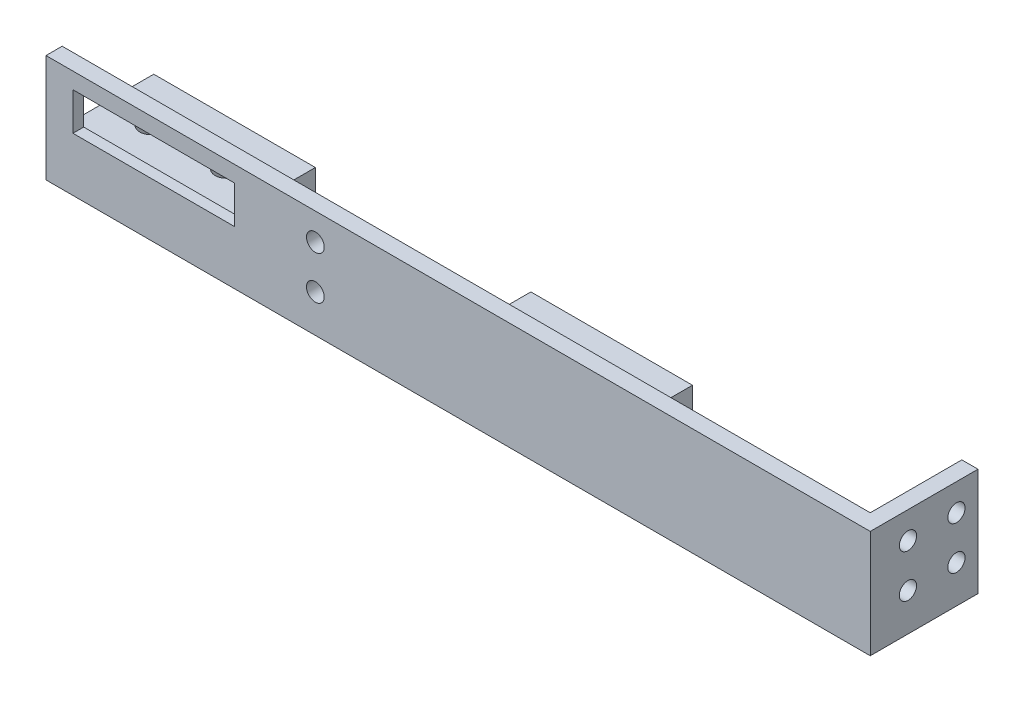
from build123d import *

# Parameters (mm, degrees)
SKETCH1_W           = 20
SKETCH1_H           = 20
BOSS_EXTRUDE1_DEPTH = 3
SKETCH2_W           = 3
SKETCH2_H           = 20
BOSS_EXTRUDE2_DEPTH = 150
SKETCH3_W           = 17
SKETCH3_H           = 3
BOSS_EXTRUDE3_DEPTH = 150
SKETCH4_R           = 1.6
CUT_EXTRUDE1_DEPTH  = 3
SKETCH5_W           = 30
SKETCH5_H           = 17
BOSS_EXTRUDE4_DEPTH = 4
SKETCH6_W           = 30
SKETCH6_H           = 17
BOSS_EXTRUDE5_DEPTH = 4
SKETCH9_R           = 2.05
SKETCH9_R_2         = 2.1
CUT_EXTRUDE4_DEPTH  = 186.434844337
SKETCH10_R          = 4
CUT_EXTRUDE5_DEPTH  = 2.5
SKETCH11_W          = 30
SKETCH11_H          = 7
CUT_EXTRUDE6_DEPTH  = 3
CHAMFER2_SIZE       = 1
CHAMFER3_SIZE       = 3
SKETCH12_W          = 3.1
SKETCH12_H          = 17
CUT_EXTRUDE7_DEPTH  = 3
SKETCH13_R          = 1.65
CUT_EXTRUDE8_DEPTH  = 3
SKETCH14_R          = 3
CUT_EXTRUDE9_DEPTH  = 6


with BuildPart() as part:
    # Sketch1 → Boss-Extrude1 (new body)
    with BuildSketch(Plane(origin=(0, 0, 0), x_dir=(0, 0, -1), z_dir=(1, 0, 0))):
        with Locations((-98.245468701, -9.501201475)):
            Rectangle(SKETCH1_W, SKETCH1_H)
    extrude(amount=BOSS_EXTRUDE1_DEPTH)

    # Sketch2 → Boss-Extrude2 (add)
    with BuildSketch(Plane.ZY):
        with Locations((106.745468701, -9.501201475)):
            Rectangle(SKETCH2_W, SKETCH2_H)
    extrude(amount=BOSS_EXTRUDE2_DEPTH)

    # Sketch3 → Boss-Extrude3 (add)
    with BuildSketch(Plane.ZY):
        with Locations((96.745468701, -18.001201475)):
            Rectangle(SKETCH3_W, SKETCH3_H)
    extrude(amount=BOSS_EXTRUDE3_DEPTH)

    # Sketch4 → Cut-Extrude1 (cut)
    with BuildSketch(Plane(origin=(3, 0, 0), x_dir=(0, 0, -1), z_dir=(1, 0, 0))):
        with Locations((-101.245468701, -4.501201475)):
            Circle(SKETCH4_R)
        with Locations((-92.245468701, -4.501201475)):
            Circle(SKETCH4_R)
        with Locations((-92.245468701, -12.501201475)):
            Circle(SKETCH4_R)
        with Locations((-101.245468701, -12.501201475)):
            Circle(SKETCH4_R)
    extrude(amount=-CUT_EXTRUDE1_DEPTH, mode=Mode.SUBTRACT)

    # Sketch5 → Boss-Extrude4 (add)
    with BuildSketch(Plane(origin=(0, -16.501201475, 0), x_dir=(1, 0, 0), z_dir=(0, 1, 0))):
        with Locations((-135, -96.745468701)):
            Rectangle(SKETCH5_W, SKETCH5_H)
    extrude(amount=BOSS_EXTRUDE4_DEPTH)

    # Sketch6 → Boss-Extrude5 (add)
    with BuildSketch(Plane(origin=(0, -16.501201475, 0), x_dir=(1, 0, 0), z_dir=(0, 1, 0))):
        with Locations((-65, -96.745468701)):
            Rectangle(SKETCH6_W, SKETCH6_H)
    extrude(amount=BOSS_EXTRUDE5_DEPTH)

    # Sketch9 → Cut-Extrude4 (cut, through all)
    with BuildSketch(Plane(origin=(0, -12.501201475, 0), x_dir=(1, 0, 0), z_dir=(0, 1, 0))):
        with Locations(Location((-58, -96.745468701, 0), (0, 0, 270))):
            Circle(SKETCH9_R)
        with Locations(Location((-72, -96.745468701, 0), (0, 0, 270))):
            Circle(SKETCH9_R_2)
        with Locations(Location((-128, -96.745468701, 0), (0, 0, 270))):
            Circle(SKETCH9_R_2)
        with Locations(Location((-142, -96.745468701, 0), (0, 0, 270))):
            Circle(SKETCH9_R_2)
    extrude(amount=-CUT_EXTRUDE4_DEPTH, mode=Mode.SUBTRACT)

    # Sketch10 → Cut-Extrude5 (cut)
    with BuildSketch(Plane.XZ.offset(19.501201475)):
        with Locations(Location((-142, 96.745468701, 0), (0, 0, 270))):
            Circle(SKETCH10_R)
        with Locations(Location((-128, 96.745468701, 0), (0, 0, 270))):
            Circle(SKETCH10_R)
        with Locations(Location((-72, 96.745468701, 0), (0, 0, 270))):
            Circle(SKETCH10_R)
        with Locations(Location((-58, 96.745468701, 0), (0, 0, 270))):
            Circle(SKETCH10_R)
    extrude(amount=-CUT_EXTRUDE5_DEPTH, mode=Mode.SUBTRACT)

    # Sketch11 → Cut-Extrude6 (cut)
    with BuildSketch(Plane.XY.offset(108.245468701)):
        with Locations((-130, -6.001201475)):
            Rectangle(SKETCH11_W, SKETCH11_H)
    extrude(amount=-CUT_EXTRUDE6_DEPTH, mode=Mode.SUBTRACT)

    # Chamfer2
    chamfer2_edges = [part.edges().sort_by_distance(p)[0] for p in [
        (-145, -6.001201475, 105.245468701),
        (-130, -2.501201475, 105.245468701),
        (-115, -6.001201475, 105.245468701),
        (-130, -9.501201475, 105.245468701),
    ]]
    chamfer(chamfer2_edges, length=CHAMFER2_SIZE)

    # Chamfer3
    chamfer3_edges = [part.edges().sort_by_distance(p)[0] for p in [
        (-100, -16.501201475, 105.245468701),
        (-25, -16.501201475, 105.245468701),
    ]]
    chamfer(chamfer3_edges, length=CHAMFER3_SIZE)

    # Sketch12 → Cut-Extrude7 (cut)
    with BuildSketch(Plane(origin=(0, -16.501201475, 0), x_dir=(1, 0, 0), z_dir=(0, 1, 0))):
        with Locations((-118.45, -96.745468701)):
            Rectangle(SKETCH12_W, SKETCH12_H)
        with Locations((-81.55, -96.745468701)):
            Rectangle(SKETCH12_W, SKETCH12_H)
        with Locations((-48.45, -96.745468701)):
            Rectangle(SKETCH12_W, SKETCH12_H)
    extrude(amount=CUT_EXTRUDE7_DEPTH, mode=Mode.SUBTRACT)

    # Sketch13 → Cut-Extrude8 (cut)
    with BuildSketch(Plane(origin=(0, 0, 105.245468701), x_dir=(-1, 0, 0), z_dir=(0, 0, -1))):
        with Locations((100, -4.501201475)):
            Circle(SKETCH13_R)
        with Locations((100, -12.501201475)):
            Circle(SKETCH13_R)
    extrude(amount=-CUT_EXTRUDE8_DEPTH, mode=Mode.SUBTRACT)

    # Sketch14 → Cut-Extrude9 (cut)
    with BuildSketch(Plane(origin=(0, 0, 105.245468701), x_dir=(-1, 0, 0), z_dir=(0, 0, -1))):
        with Locations((100, -12.501201475)):
            Circle(SKETCH14_R)
    extrude(amount=CUT_EXTRUDE9_DEPTH, mode=Mode.SUBTRACT)


solid = part.part
